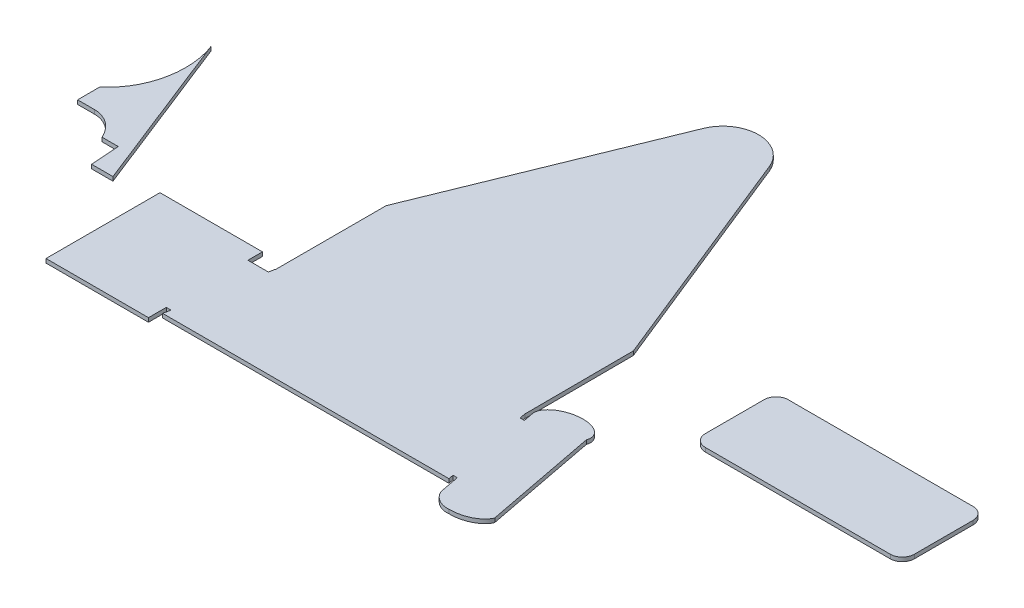
from build123d import *

# Parameters (mm, degrees)
BOSS_EXTRUDE1_DEPTH = 10
BOSS_EXTRUDE2_DEPTH = 10
BOSS_EXTRUDE3_DEPTH = 10


with BuildPart() as part:
    # Sketch1 → Boss-Extrude1 (new body)
    with BuildSketch(Plane(origin=(0, 0, 0), x_dir=(1, 0, 0), z_dir=(0, 1, 0))):
        with BuildLine():
            Line((52.712981147, -200.46355289), (47.790345597, -129.154704003))
            Line((47.790345597, -129.154704003), (7.546555416, -129.154704003))
            add(Edge.make_bspline(
                [(-61.78325808, -79.049159175), (-59.624624056, -79.112045243), (-55.427904423, -79.234305519), (-49.389122898, -80.172269264), (-43.85279654, -81.513461678), (-38.874327208, -83.172102105), (-34.486803674, -84.997618704), (-30.704381342, -86.863222673), (-26.372562418, -89.301162722), (-21.495910227, -92.5282526), (-12.950036968, -99.343739915), (-2.253816449, -111.022656411), (4.566450288, -122.685389209), (7.546555416, -129.154704003)],
                knots=[0, 0, 0, 0, 0.04544241, 0.088347099, 0.128406028, 0.165306616, 0.198741876, 0.228422313, 0.254086731, 0.303421336, 0.35144752, 0.484303034, 0.635079233, 0.635079233, 0.635079233, 0.635079233], degree=3))
            Line((-61.78325808, -79.049159175), (-103.462229108, -79.049159175))
            Line((-103.462229108, -79.049159175), (-103.629081372, -22.92287626))
            add(Edge.make_bspline(
                [(-103.629081372, -22.92287626), (2.742841741, 61.171512772), (-52.870933457, 202.305804128)],
                knots=[3.705535295, 3.705535295, 3.705535295, 5.170067535, 5.170067535, 5.170067535], degree=2, weights=[1, 0.743661284, 1]))
            Line((-52.870933457, 202.305804128), (105.839782858, -200.46355289))
            Line((105.839782858, -200.46355289), (52.712981147, -200.46355289))
        make_face()
    extrude(amount=BOSS_EXTRUDE1_DEPTH)


with BuildPart() as body_2:
    # Sketch3 → Boss-Extrude2 (new body)
    with BuildSketch(Plane(origin=(0, 0, 0), x_dir=(1, 0, 0), z_dir=(0, 1, 0))):
        with BuildLine():
            Line((1128.899745939, 71.518232222), (899.997264322, 639.805151885))
            ThreePointArc((899.997264322, 639.805151885), (818.661659338, 693.069632592), (737.313859069, 639.823778908))
            Line((737.313859069, 639.823778908), (508.403094205, 76.72722767))
            Line((508.403094205, 76.72722767), (508.403094205, -199.483404134))
            Line((508.403094205, -199.483404134), (507.403094205, -199.855558726))
            Line((507.403094205, -199.855558726), (504.904572588, -212.845486475))
            Line((504.904572588, -212.845486475), (454.052065144, -212.845486475))
            Line((454.052065144, -212.845486475), (454.052065144, -176.675723923))
            Line((454.052065144, -176.675723923), (199.052065144, -176.675723923))
            Line((199.052065144, -176.675723923), (199.052065144, -460.298738681))
            Line((199.052065144, -460.298738681), (454.052065144, -460.298738681))
            Line((454.052065144, -460.298738681), (454.052065144, -415.992210629))
            Line((454.052065144, -415.992210629), (465.830723093, -415.992210629))
            Line((465.830723093, -415.992210629), (462.469305937, -433.468371605))
            Line((462.469305937, -433.468371605), (818.651419411, -433.468371605))
            Line((818.651419411, -433.468371605), (1174.833534208, -433.468371605))
            Line((1174.833534208, -433.468371605), (1172.428602461, -420.964947552))
            Line((1172.428602461, -420.964947552), (1183.094477094, -420.964947552))
            Line((1183.094477094, -420.964947552), (1192.858446813, -471.728572756))
            ThreePointArc((1192.858446813, -471.728572756), (1212.654596204, -493.115293069), (1241.160905905, -499.170839593))
            add(Edge.make_bspline(
                [(1241.160905905, -499.170839593), (1302.342117862, -500.447901399), (1316.396673087, -461.011770903)],
                knots=[1.229562744, 1.229562744, 1.229562744, 2.80035907, 2.80035907, 2.80035907], degree=2, weights=[1, 0.707106781, 1]))
            Line((1316.396673087, -461.011770903), (1262.143367489, -178.944686432))
            add(Edge.make_bspline(
                [(1262.143367489, -178.944686432), (1278.826483722, -132.132991693), (1204.424670567, -138.587265104), (1130.022857412, -145.041538515), (1138.605141215, -189.661488285)],
                knots=[5.941951724, 5.941951724, 5.941951724, 7.683364842, 7.683364842, 9.424777961, 9.424777961, 9.424777961], degree=2, weights=[1, 0.644286343, 1, 0.644286343, 1]))
            Line((1138.605141215, -189.661488285), (1143.322812908, -214.189024171))
            Line((1143.322812908, -214.189024171), (1132.61394394, -213.965493334))
            Line((1132.61394394, -213.965493334), (1129.899745939, -199.854170377))
            Line((1129.899745939, -199.854170377), (1128.899745939, 71.518232222))
        make_face()
    extrude(amount=BOSS_EXTRUDE2_DEPTH)


with BuildPart() as body_3:
    # Sketch4 → Boss-Extrude3 (new body)
    with BuildSketch(Plane(origin=(0, 0, 0), x_dir=(1, 0, 0), z_dir=(0, 1, 0))):
        with BuildLine():
            Line((1426.708497639, -47.198712871), (1886.708497639, -47.198712871))
            ThreePointArc((1886.708497639, -47.198712871), (1907.921701074, -38.411916307), (1916.708497639, -17.198712871))
            Line((1916.708497639, -17.198712871), (1916.708497639, 128.801287129))
            ThreePointArc((1916.708497639, 128.801287129), (1907.921701074, 150.014490564), (1886.708497639, 158.801287129))
            Line((1886.708497639, 158.801287129), (1426.708497639, 158.801287129))
            ThreePointArc((1426.708497639, 158.801287129), (1405.495294203, 150.014490564), (1396.708497639, 128.801287129))
            Line((1396.708497639, 128.801287129), (1396.708497639, -17.198712871))
            ThreePointArc((1396.708497639, -17.198712871), (1405.495294203, -38.411916307), (1426.708497639, -47.198712871))
        make_face()
    extrude(amount=BOSS_EXTRUDE3_DEPTH)


solid = Compound([part.part, body_2.part, body_3.part])
